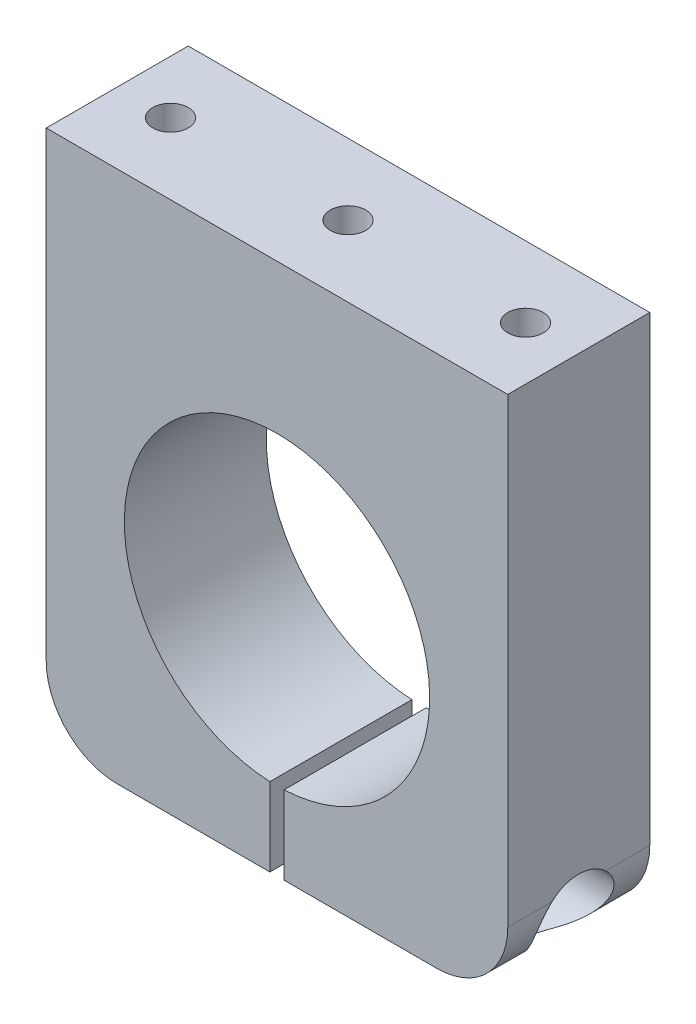
from build123d import *

# Parameters (mm, degrees)
AUFSATZ_LINEAR_AUSTRAGEN1_DEPTH = 20
M6_GEWINDEBOHRUNG1_D            = 5
M6_GEWINDEBOHRUNG1_DEPTH        = 17
M6_GEWINDEBOHRUNG1_TIP          = 1.502151548
SKIZZE4_R                       = 3
SCHNITT_LINEAR_AUSTRAGEN1_DEPTH = 40
SCHNITT_LINEAR_START            = 20
SKIZZE5_R                       = 5.5
SCHNITT_LINEAR_AUSTRAGEN2_DEPTH = 20


with BuildPart() as part:
    # Skizze1 → Aufsatz-Linear austragen1 (new body)
    with BuildSketch(Plane.XY):
        with BuildLine():
            Line((-32.5, 42.5), (32.5, 42.5))
            Line((32.5, 42.5), (32.5, -22.5))
            ThreePointArc((32.5, -22.5), (29.571067812, -29.571067812), (22.5, -32.5))
            Line((22.5, -32.5), (1, -32.5))
            Line((1, -32.5), (1, -21.476731595))
            ThreePointArc((1, -21.476731595), (0, 21.5), (-1, -21.476731595))
            Line((-1, -21.476731595), (-1, -32.5))
            Line((-1, -32.5), (-22.5, -32.5))
            ThreePointArc((-22.5, -32.5), (-29.571067812, -29.571067812), (-32.5, -22.5))
            Line((-32.5, -22.5), (-32.5, 42.5))
        make_face()
    extrude(amount=AUFSATZ_LINEAR_AUSTRAGEN1_DEPTH)

    # M6 Gewindebohrung1
    with Locations(Plane(origin=(0, 42.5, 0), x_dir=(1, 0, 0), z_dir=(0, 1, 0))):
        with Locations((-25, -10), (0, -10), (25, -10)):
            Hole(M6_GEWINDEBOHRUNG1_D / 2, depth=M6_GEWINDEBOHRUNG1_DEPTH)
            with Locations((0, 0, -(M6_GEWINDEBOHRUNG1_DEPTH + M6_GEWINDEBOHRUNG1_TIP / 2))):  # 118° drill point
                Cone(0, M6_GEWINDEBOHRUNG1_D / 2, M6_GEWINDEBOHRUNG1_TIP, mode=Mode.SUBTRACT)

    # Skizze4 → Schnitt-Linear austragen1 (cut)
    with BuildSketch(Plane(origin=(0, 0, 0), x_dir=(0, 0, -1), z_dir=(1, 0, 0))):
        with Locations(Location((-10, -26.5, 0), (0, 0, 180))):
            Circle(SKIZZE4_R)
    extrude(amount=SCHNITT_LINEAR_AUSTRAGEN1_DEPTH, mode=Mode.SUBTRACT)

    # Skizze5 → Schnitt-Linear austragen2 (cut)
    with BuildSketch(Plane(origin=(0, 0, 0), x_dir=(0, 0, -1), z_dir=(1, 0, 0)).offset(SCHNITT_LINEAR_START)):
        with Locations(Location((-10, -26.5, 0), (0, 0, 133.341758227))):
            Circle(SKIZZE5_R)
    extrude(amount=SCHNITT_LINEAR_AUSTRAGEN2_DEPTH, mode=Mode.SUBTRACT)


solid = part.part
